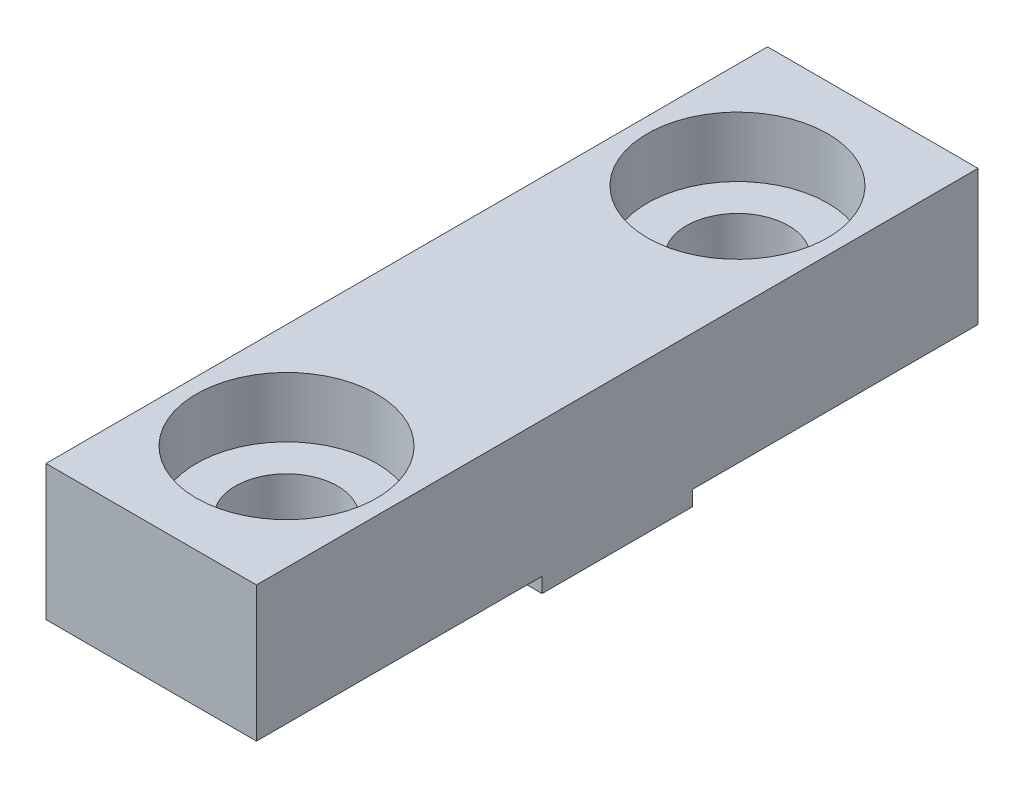
from build123d import *

# Parameters (mm, degrees)
SKETCH1_W           = 7
SKETCH1_H           = 24
BOSS_EXTRUDE1_DEPTH = 4.5
SKETCH2_W           = 7
SKETCH2_H           = 5
BOSS_EXTRUDE2_DEPTH = 0.5
SKETCH3_R           = 1.7
CUT_EXTRUDE1_DEPTH  = 57.515484604
SKETCH4_R           = 3
CUT_EXTRUDE2_DEPTH  = 2


with BuildPart() as part:
    # Sketch1 → Boss-Extrude1 (new body)
    with BuildSketch(Plane(origin=(0, 6, 0), x_dir=(1, 0, 0), z_dir=(0, 1, 0))):
        with Locations((-51.5, 0)):
            Rectangle(SKETCH1_W, SKETCH1_H)
    extrude(amount=BOSS_EXTRUDE1_DEPTH)

    # Sketch2 → Boss-Extrude2 (add)
    with BuildSketch(Plane(origin=(0, 6, 0), x_dir=(1, 0, 0), z_dir=(0, 1, 0))):
        with Locations((-51.5, 0)):
            Rectangle(SKETCH2_W, SKETCH2_H)
    extrude(amount=-BOSS_EXTRUDE2_DEPTH)

    # Sketch3 → Cut-Extrude1 (cut, through all)
    with BuildSketch(Plane(origin=(0, 10.5, 0), x_dir=(1, 0, 0), z_dir=(0, 1, 0))):
        with Locations(Location((-51.5, 7.5, 0), (0, 0, 270))):
            Circle(SKETCH3_R)
        with Locations(Location((-51.5, -7.5, 0), (0, 0, 270))):
            Circle(SKETCH3_R)
    extrude(amount=-CUT_EXTRUDE1_DEPTH, mode=Mode.SUBTRACT)

    # Sketch4 → Cut-Extrude2 (cut)
    with BuildSketch(Plane(origin=(0, 10.5, 0), x_dir=(1, 0, 0), z_dir=(0, 1, 0))):
        with Locations(Location((-51.5, 7.5, 0), (0, 0, 270))):
            Circle(SKETCH4_R)
        with Locations(Location((-51.5, -7.5, 0), (0, 0, 270))):
            Circle(SKETCH4_R)
    extrude(amount=-CUT_EXTRUDE2_DEPTH, mode=Mode.SUBTRACT)


solid = part.part
